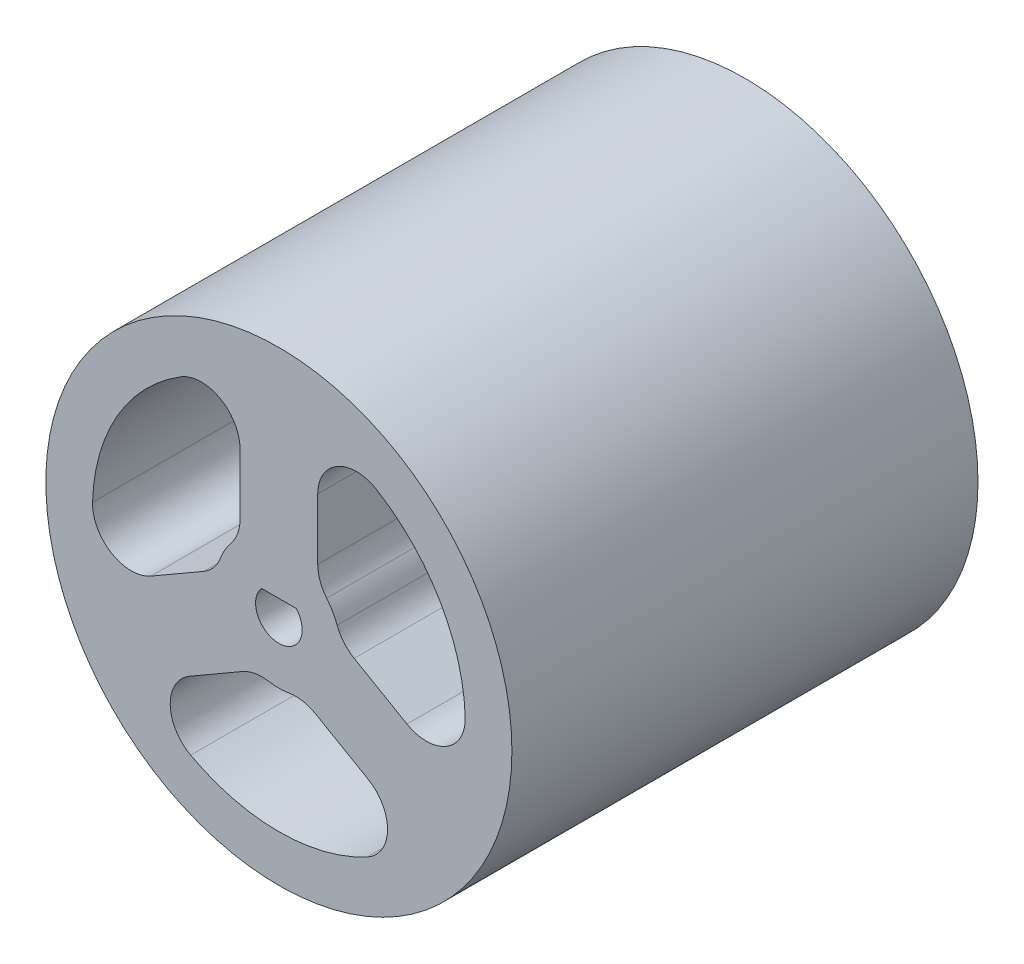
from build123d import *

# Parameters (mm, degrees)
SZKIC1_R                        = 30
DODANIE_WYCI_GNI_CIE1_DEPTH     = 60
WYTNIJ_WYCI_GNI_CIE1_DEPTH      = 74.484692283
WYTNIJ_WYCI_GNI_CIE1_DEPTH_BACK = 13
WYTNIJ_WYCI_GNI_CIE4_DEPTH      = 74.484692283
ZAOKR_GLENIE2_R                 = 5


with BuildPart() as part:
    # Szkic1 → Dodanie-wyciągnięcie1 (new body)
    with BuildSketch(Plane.XY):
        Circle(SZKIC1_R)
    extrude(amount=DODANIE_WYCI_GNI_CIE1_DEPTH)

    # Szkic3 → Wytnij-wyciągnięcie1 (cut, two sides: drawn at the far end of the back side and taken through both)
    with BuildSketch(Plane.XY.offset(60).offset(-WYTNIJ_WYCI_GNI_CIE1_DEPTH_BACK)):
        with BuildLine():
            Line((2.224367528, 2.013004993), (-2.224367528, 2.013004993))
            ThreePointArc((-2.224367528, 2.013004993), (0, -3), (2.224367528, 2.013004993))
        make_face()
    extrude(amount=WYTNIJ_WYCI_GNI_CIE1_DEPTH + WYTNIJ_WYCI_GNI_CIE1_DEPTH_BACK, mode=Mode.SUBTRACT)

    # Szkic4 → Wytnij-wyciągnięcie4 (cut, through all)
    with BuildSketch(Plane.XY.offset(60)):
        with BuildLine():
            ThreePointArc((-7.908326913, 1.20762802), (-6.92820323, 4), (-5, 6.244997998))
            Line((-5, 6.244997998), (-5, 23.473389189))
            ThreePointArc((-5, 23.473389189), (-20.784609691, 12), (-22.82855135, -7.406567575))
            Line((-22.82855135, -7.406567575), (-7.908326913, 1.20762802))
        make_face()
        with BuildLine():
            Line((5, 23.473389189), (5, 6.244997998))
            ThreePointArc((5, 6.244997998), (6.92820323, 4), (7.908326913, 1.20762802))
            Line((7.908326913, 1.20762802), (22.82855135, -7.406567575))
            ThreePointArc((22.82855135, -7.406567575), (23.705328857, -3.749317778), (24, 0))
            ThreePointArc((24, 0), (18.654758106, 15.099668871), (5, 23.473389189))
        make_face()
        with BuildLine():
            ThreePointArc((2.908326913, -7.452626018), (0, -8), (-2.908326913, -7.452626018))
            Line((-2.908326913, -7.452626018), (-17.82855135, -16.066821613))
            ThreePointArc((-17.82855135, -16.066821613), (0, -24), (17.82855135, -16.066821613))
            Line((17.82855135, -16.066821613), (2.908326913, -7.452626018))
        make_face()
    extrude(amount=-WYTNIJ_WYCI_GNI_CIE4_DEPTH, mode=Mode.SUBTRACT)

    # Zaokrąglenie2
    zaokr_glenie2_edges = [part.edges().sort_by_distance(p)[0] for p in [
        (-17.82855135, -16.066821613, 30),
        (-2.908326913, -7.452626018, 30),
        (2.908326913, -7.452626018, 30),
        (17.82855135, -16.066821613, 30),
        (22.82855135, -7.406567575, 30),
        (7.908326913, 1.20762802, 30),
        (5, 6.244997998, 30),
        (5, 23.473389189, 30),
        (-5, 23.473389189, 30),
        (-5, 6.244997998, 30),
        (-7.908326913, 1.20762802, 30),
        (-22.82855135, -7.406567575, 30),
    ]]
    fillet(zaokr_glenie2_edges, radius=ZAOKR_GLENIE2_R)


solid = part.part
